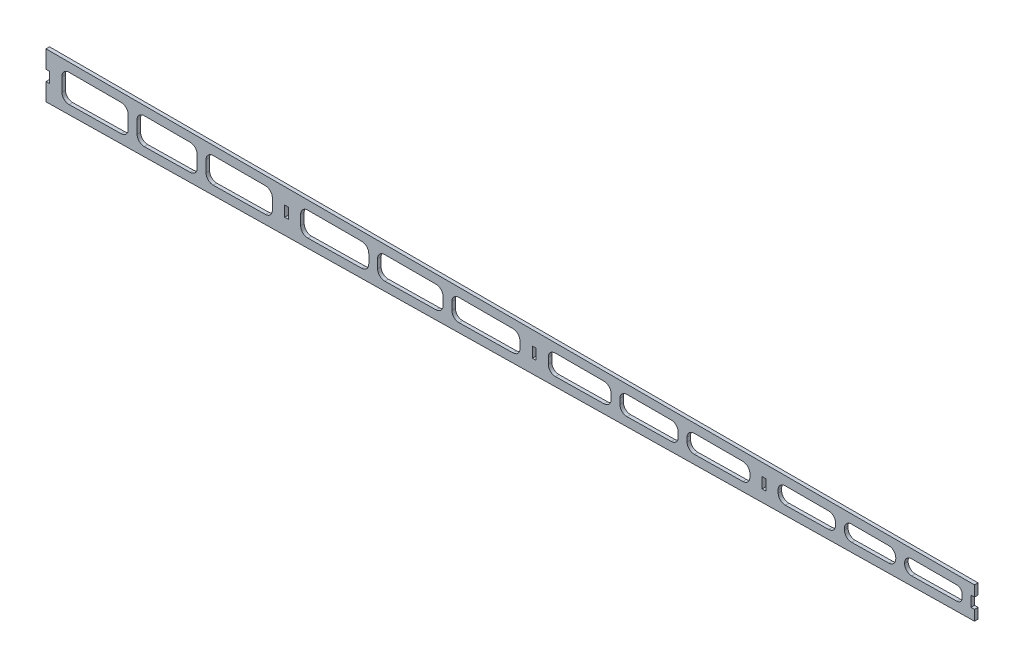
from build123d import *

# Parameters (mm, degrees)
SKETCH_1_W      = 2
SKETCH_1_H      = 6
EXTRUDE_1_DEPTH = 2


with BuildPart() as part:
    # 草图1 → 凸台-拉伸1 (new body)
    with BuildSketch(Plane.XY):
        Polygon((529.48584496, 31.739769875), (4.48584496, 31.739769875), (4.48584496, 21.739769875), (6.48584496, 21.739769875), (6.48584496, 15.739769875), (4.48584496, 15.739769875), (4.48584496, 5.770075294), (529.48584496, 13.938813064), (529.48584496, 19.739769875), (527.48584496, 19.739769875), (527.48584496, 25.739769875), (529.48584496, 25.739769875), align=None)
        with Locations((140.48584496, 19.739769875)):
            Rectangle(SKETCH_1_W, SKETCH_1_H, mode=Mode.SUBTRACT)
        with Locations((280.48584496, 20.739769875)):
            Rectangle(SKETCH_1_W, SKETCH_1_H, mode=Mode.SUBTRACT)
        with Locations((410.48584496, 21.739769875)):
            Rectangle(SKETCH_1_W, SKETCH_1_H, mode=Mode.SUBTRACT)
        with BuildLine():
            Line((13.48584496, 22.739769875), (13.48584496, 14.973438176))
            ThreePointArc((13.48584496, 14.973438176), (14.679505875, 12.123094173), (17.54807543, 10.973922284))
            Line((17.54807543, 10.973922284), (47.04807543, 11.43292755))
            ThreePointArc((47.04807543, 11.43292755), (49.836188964, 12.626104356), (50.98584496, 15.432443441))
            Line((50.98584496, 15.432443441), (50.98584496, 22.739769875))
            ThreePointArc((50.98584496, 22.739769875), (49.814272085, 25.568196999), (46.98584496, 26.739769875))
            Line((46.98584496, 26.739769875), (17.48584496, 26.739769875))
            ThreePointArc((17.48584496, 26.739769875), (14.657417835, 25.568196999), (13.48584496, 22.739769875))
        make_face(mode=Mode.SUBTRACT)
        with BuildLine():
            Line((55.98584496, 22.739769875), (55.98584496, 15.634716948))
            ThreePointArc((55.98584496, 15.634716948), (57.179505875, 12.784372944), (60.04807543, 11.635201056))
            Line((60.04807543, 11.635201056), (86.04807543, 12.03974807))
            ThreePointArc((86.04807543, 12.03974807), (88.836188964, 13.232924876), (89.98584496, 16.039263961))
            Line((89.98584496, 16.039263961), (89.98584496, 22.739769875))
            ThreePointArc((89.98584496, 22.739769875), (88.814272085, 25.568196999), (85.98584496, 26.739769875))
            Line((85.98584496, 26.739769875), (59.98584496, 26.739769875))
            ThreePointArc((59.98584496, 26.739769875), (57.157417835, 25.568196999), (55.98584496, 22.739769875))
        make_face(mode=Mode.SUBTRACT)
        with BuildLine():
            Line((94.98584496, 22.739769875), (94.98584496, 16.241537468))
            ThreePointArc((94.98584496, 16.241537468), (96.179505875, 13.391193464), (99.04807543, 12.242021576))
            Line((99.04807543, 12.242021576), (128.54807543, 12.701026841))
            ThreePointArc((128.54807543, 12.701026841), (131.336188964, 13.894203648), (132.48584496, 16.700542733))
            Line((132.48584496, 16.700542733), (132.48584496, 22.739769875))
            ThreePointArc((132.48584496, 22.739769875), (131.314272085, 25.568196999), (128.48584496, 26.739769875))
            Line((128.48584496, 26.739769875), (98.98584496, 26.739769875))
            ThreePointArc((98.98584496, 26.739769875), (96.157417835, 25.568196999), (94.98584496, 22.739769875))
        make_face(mode=Mode.SUBTRACT)
        with BuildLine():
            Line((148.48584496, 22.739769875), (148.48584496, 17.073970745))
            ThreePointArc((148.48584496, 17.073970745), (149.679505875, 14.223626742), (152.54807543, 13.074454854))
            Line((152.54807543, 13.074454854), (183.04807543, 13.549019619))
            ThreePointArc((183.04807543, 13.549019619), (185.836188964, 14.742196426), (186.98584496, 17.548535511))
            Line((186.98584496, 17.548535511), (186.98584496, 22.739769875))
            ThreePointArc((186.98584496, 22.739769875), (185.814272085, 25.568196999), (182.98584496, 26.739769875))
            Line((182.98584496, 26.739769875), (152.48584496, 26.739769875))
            ThreePointArc((152.48584496, 26.739769875), (149.657417835, 25.568196999), (148.48584496, 22.739769875))
        make_face(mode=Mode.SUBTRACT)
        with BuildLine():
            Line((191.98584496, 22.739769875), (191.98584496, 17.750809018))
            ThreePointArc((191.98584496, 17.750809018), (193.179505875, 14.900465014), (196.04807543, 13.751293126))
            Line((196.04807543, 13.751293126), (225.04807543, 14.202518641))
            ThreePointArc((225.04807543, 14.202518641), (227.836188964, 15.395695448), (228.98584496, 18.202034533))
            Line((228.98584496, 18.202034533), (228.98584496, 22.739769875))
            ThreePointArc((228.98584496, 22.739769875), (227.814272085, 25.568196999), (224.98584496, 26.739769875))
            Line((224.98584496, 26.739769875), (195.98584496, 26.739769875))
            ThreePointArc((195.98584496, 26.739769875), (193.157417835, 25.568196999), (191.98584496, 22.739769875))
        make_face(mode=Mode.SUBTRACT)
        with BuildLine():
            Line((233.98584496, 22.739769875), (233.98584496, 18.404308039))
            ThreePointArc((233.98584496, 18.404308039), (235.179505875, 15.553964036), (238.04807543, 14.404792148))
            Line((238.04807543, 14.404792148), (268.54807543, 14.879356913))
            ThreePointArc((268.54807543, 14.879356913), (271.336188964, 16.07253372), (272.48584496, 18.878872805))
            Line((272.48584496, 18.878872805), (272.48584496, 22.739769875))
            ThreePointArc((272.48584496, 22.739769875), (271.314272085, 25.568196999), (268.48584496, 26.739769875))
            Line((268.48584496, 26.739769875), (237.98584496, 26.739769875))
            ThreePointArc((237.98584496, 26.739769875), (235.157417835, 25.568196999), (233.98584496, 22.739769875))
        make_face(mode=Mode.SUBTRACT)
        with BuildLine():
            Line((288.48584496, 22.739769875), (288.48584496, 19.252300817))
            ThreePointArc((288.48584496, 19.252300817), (289.679505875, 16.401956814), (292.54807543, 15.252784926))
            Line((292.54807543, 15.252784926), (320.04807543, 15.68067119))
            ThreePointArc((320.04807543, 15.68067119), (322.836188964, 16.873847996), (323.98584496, 19.680187081))
            Line((323.98584496, 19.680187081), (323.98584496, 22.739769875))
            ThreePointArc((323.98584496, 22.739769875), (322.814272085, 25.568196999), (319.98584496, 26.739769875))
            Line((319.98584496, 26.739769875), (292.48584496, 26.739769875))
            ThreePointArc((292.48584496, 26.739769875), (289.657417835, 25.568196999), (288.48584496, 22.739769875))
        make_face(mode=Mode.SUBTRACT)
        with BuildLine():
            Line((328.98584496, 22.739769875), (328.98584496, 19.882460588))
            ThreePointArc((328.98584496, 19.882460588), (330.179505875, 17.032116584), (333.04807543, 15.882944696))
            Line((333.04807543, 15.882944696), (358.04807543, 16.271932209))
            ThreePointArc((358.04807543, 16.271932209), (360.836188964, 17.465109016), (361.98584496, 20.271448101))
            Line((361.98584496, 20.271448101), (361.98584496, 22.739769875))
            ThreePointArc((361.98584496, 22.739769875), (360.814272085, 25.568196999), (357.98584496, 26.739769875))
            Line((357.98584496, 26.739769875), (332.98584496, 26.739769875))
            ThreePointArc((332.98584496, 26.739769875), (330.157417835, 25.568196999), (328.98584496, 22.739769875))
        make_face(mode=Mode.SUBTRACT)
        with BuildLine():
            Line((366.98584496, 22.739769875), (366.98584496, 20.473721608))
            ThreePointArc((366.98584496, 20.473721608), (368.179505875, 17.623377604), (371.04807543, 16.474205716))
            Line((371.04807543, 16.474205716), (398.54807543, 16.90209198))
            ThreePointArc((398.54807543, 16.90209198), (401.336188964, 18.095268787), (402.48584496, 20.901607872))
            Line((402.48584496, 20.901607872), (402.48584496, 22.739769875))
            ThreePointArc((402.48584496, 22.739769875), (401.314272085, 25.568196999), (398.48584496, 26.739769875))
            Line((398.48584496, 26.739769875), (370.98584496, 26.739769875))
            ThreePointArc((370.98584496, 26.739769875), (368.157417835, 25.568196999), (366.98584496, 22.739769875))
        make_face(mode=Mode.SUBTRACT)
        with BuildLine():
            Line((418.48584496, 22.739769875), (418.48584496, 21.275035884))
            ThreePointArc((418.48584496, 21.275035884), (419.679505875, 18.42469188), (422.54807543, 17.275519992))
            Line((422.54807543, 17.275519992), (447.04807543, 17.656727755))
            ThreePointArc((447.04807543, 17.656727755), (449.836188964, 18.849904561), (450.98584496, 21.656243647))
            Line((450.98584496, 21.656243647), (450.98584496, 22.739769875))
            ThreePointArc((450.98584496, 22.739769875), (449.814272085, 25.568196999), (446.98584496, 26.739769875))
            Line((446.98584496, 26.739769875), (422.48584496, 26.739769875))
            ThreePointArc((422.48584496, 26.739769875), (419.657417835, 25.568196999), (418.48584496, 22.739769875))
        make_face(mode=Mode.SUBTRACT)
        with BuildLine():
            Line((455.98584496, 22.739769875), (455.98584496, 21.858517153))
            ThreePointArc((455.98584496, 21.858517153), (457.179505875, 19.00817315), (460.04807543, 17.859001262))
            Line((460.04807543, 17.859001262), (481.04807543, 18.185750772))
            ThreePointArc((481.04807543, 18.185750772), (483.836188964, 19.378927579), (484.98584496, 22.185266664))
            Line((484.98584496, 22.185266664), (484.98584496, 22.739769875))
            ThreePointArc((484.98584496, 22.739769875), (483.814272085, 25.568196999), (480.98584496, 26.739769875))
            Line((480.98584496, 26.739769875), (459.98584496, 26.739769875))
            ThreePointArc((459.98584496, 26.739769875), (457.157417835, 25.568196999), (455.98584496, 22.739769875))
        make_face(mode=Mode.SUBTRACT)
        with BuildLine():
            Line((489.98584496, 22.739769875), (489.98584496, 22.387540171))
            ThreePointArc((489.98584496, 22.387540171), (491.179505875, 19.537196167), (494.04807543, 18.388024279))
            Line((494.04807543, 18.388024279), (519.532517812, 18.784549473))
            ThreePointArc((519.532517812, 18.784549473), (521.623602963, 19.679432078), (522.48584496, 21.784186392))
            Line((522.48584496, 21.784186392), (522.48584496, 23.739769875))
            ThreePointArc((522.48584496, 23.739769875), (521.607165304, 25.861090218), (519.48584496, 26.739769875))
            Line((519.48584496, 26.739769875), (493.98584496, 26.739769875))
            ThreePointArc((493.98584496, 26.739769875), (491.157417835, 25.568196999), (489.98584496, 22.739769875))
        make_face(mode=Mode.SUBTRACT)
    extrude(amount=EXTRUDE_1_DEPTH)


solid = part.part
